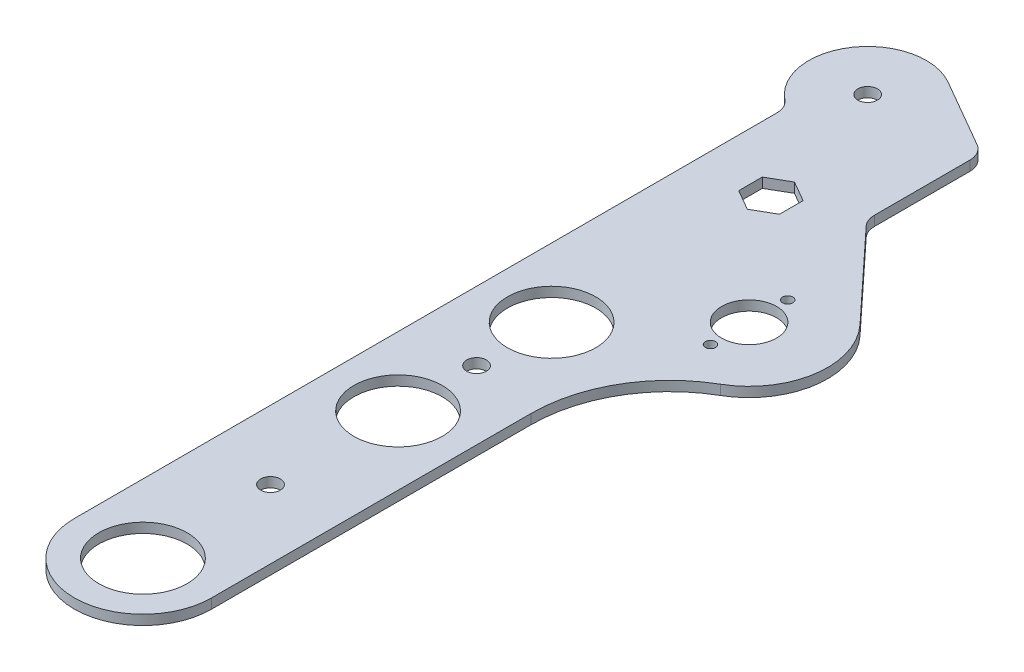
from build123d import *

# Parameters (mm, degrees)
SKETCH1_R           = 14.2875
SKETCH1_R_2         = 3.175
SKETCH1_R_3         = 8.89
SKETCH1_R_4         = 1.650000002
BOSS_EXTRUDE1_DEPTH = 3.175


with BuildPart() as part:
    # Sketch1 → Boss-Extrude1 (new body)
    with BuildSketch(Plane(origin=(0, 0, 0), x_dir=(1, 0, 0), z_dir=(0, 1, 0))):
        with BuildLine():
            Line((0, 24.166221867), (0, -203.2))
            ThreePointArc((0, -203.2), (22.225, -225.425), (44.45, -203.2))
            Line((44.45, -203.2), (44.45, -99.857166641))
            ThreePointArc((44.45, -99.857166641), (50.459229894, -77.430415362), (66.876751279, -61.012893977))
            ThreePointArc((66.876751279, -61.012893977), (79.295297798, -42.786607364), (72.775737997, -21.717360549))
            Line((72.775737997, -21.717360549), (46.15025332, 6.909825302))
            ThreePointArc((46.15025332, 6.909825302), (44.890330322, 8.911022224), (44.45, 11.234447345))
            Line((44.45, 11.234447345), (44.45, 42.161003408))
            ThreePointArc((44.45, 42.161003408), (43.599261314, 45.336003408), (41.275, 47.660264722))
            Line((41.275, 47.660264722), (19.05, 60.491874454))
            ThreePointArc((19.05, 60.491874454), (-6.204468975, 54.74054601), (-2.38125, 29.123189029))
            ThreePointArc((-2.38125, 29.123189029), (-0.62618735, 26.915852524), (0, 24.166221867))
        make_face()
        with Locations(Location((22.225, -203.2, 0), (0, 0, 270))):
            Circle(SKETCH1_R, mode=Mode.SUBTRACT)
        with Locations(Location((22.225, -120.65, 0), (0, 0, 270))):
            Circle(SKETCH1_R, mode=Mode.SUBTRACT)
        with Locations(Location((22.225, -70.9676, 0), (0, 0, 270))):
            Circle(SKETCH1_R, mode=Mode.SUBTRACT)
        with Locations(Location((22.225, -95.25, 0), (0, 0, 270))):
            Circle(SKETCH1_R_2, mode=Mode.SUBTRACT)
        with Locations(Location((22.225, -161.925, 0), (0, 0, 270))):
            Circle(SKETCH1_R_2, mode=Mode.SUBTRACT)
        with Locations(Location((9.525, 43.994090512, 0), (0, 0, 270))):
            Circle(SKETCH1_R_2, mode=Mode.SUBTRACT)
        with Locations(Location((54.176751279, -39.015848721, 0), (0, 0, 270))):
            Circle(SKETCH1_R_3, mode=Mode.SUBTRACT)
        with Locations(Location((54.176751279, -51.515848613, 0), (0, 0, 270))):
            Circle(SKETCH1_R_4, mode=Mode.SUBTRACT)
        with Locations(Location((54.176751279, -26.515848829, 0), (0, 0, 270))):
            Circle(SKETCH1_R_4, mode=Mode.SUBTRACT)
        Polygon((22.225, -7.625642355), (28.829, -3.812821178), (28.829, 3.812821178), (22.225, 7.625642355), (15.621, 3.812821178), (15.621, -3.812821178), align=None, mode=Mode.SUBTRACT)
    extrude(amount=BOSS_EXTRUDE1_DEPTH)


solid = part.part
